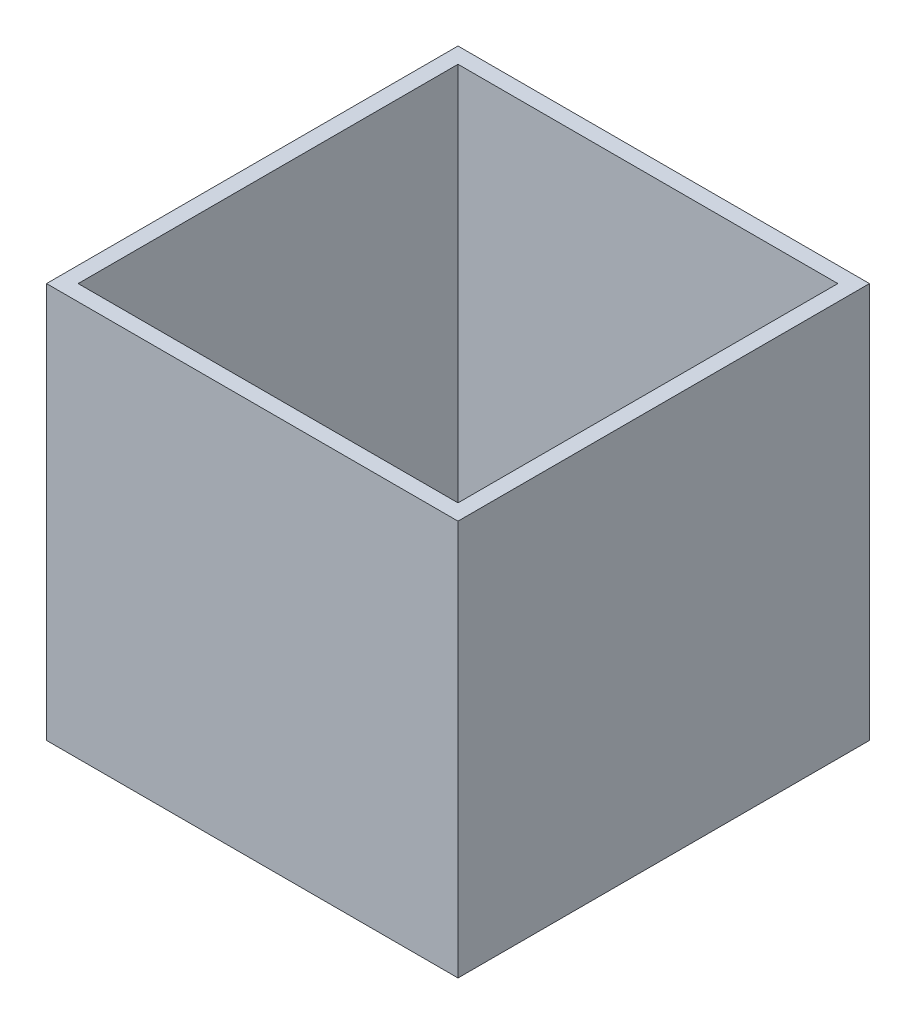
from build123d import *

# Parameters (mm, degrees)
SKETCH1_W           = 330.2
SKETCH1_H           = 330.2
BOSS_EXTRUDE1_DEPTH = 317.5
SHELL1_T            = -12.7


with BuildPart() as part:
    # Sketch1 → Boss-Extrude1 (new body)
    with BuildSketch(Plane(origin=(0, 0, 0), x_dir=(1, 0, 0), z_dir=(0, 1, 0))):
        with Locations((165.1, 165.1)):
            Rectangle(SKETCH1_W, SKETCH1_H)
    extrude(amount=BOSS_EXTRUDE1_DEPTH)

    # Shell1
    shell1_openings = [part.faces().sort_by_distance(p)[0] for p in [
        (165.1, 317.5, -165.1),
    ]]
    offset(amount=SHELL1_T, openings=shell1_openings, kind=Kind.INTERSECTION)


solid = part.part
